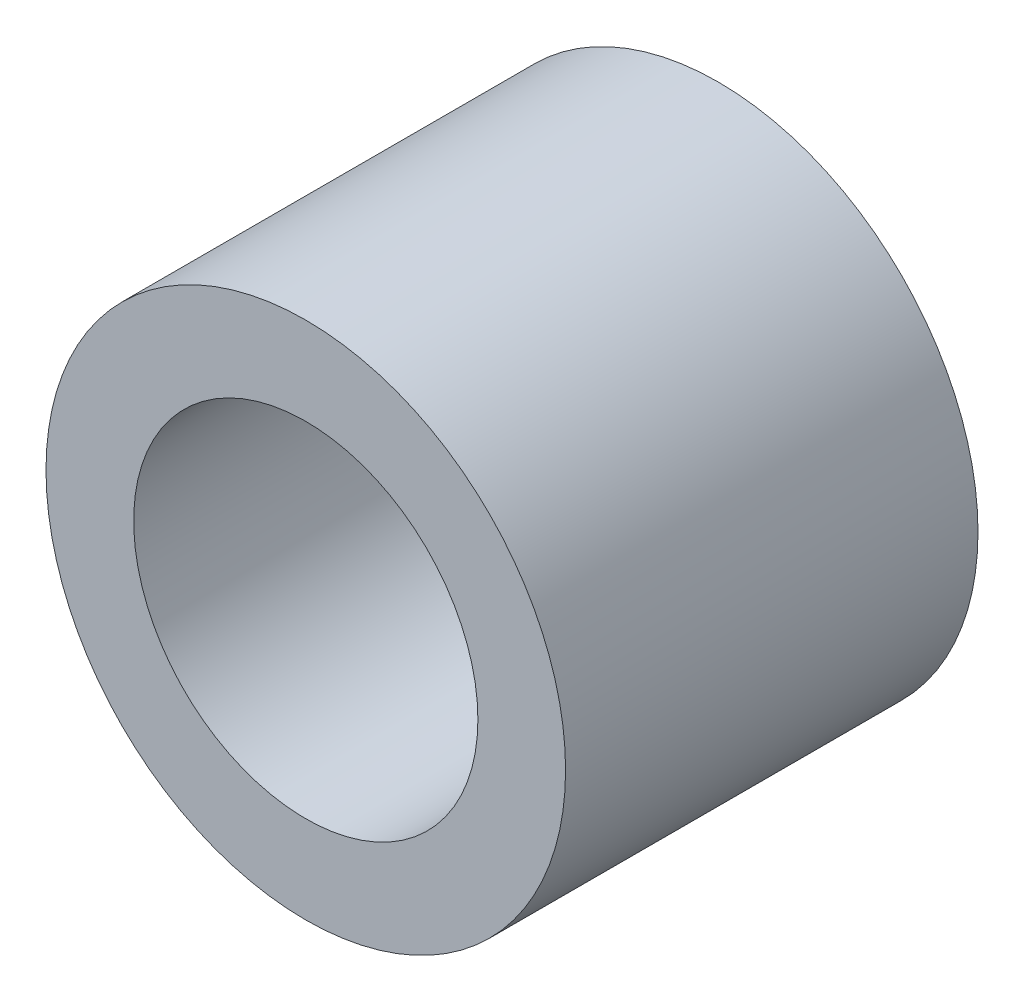
from build123d import *

# Parameters (mm, degrees)
ESQUISSE1_R        = 4
ESQUISSE1_R_2      = 2.65
BOSS_EXTRU_1_DEPTH = 3.175


with BuildPart() as part:
    # Esquisse1 → Boss.-Extru.1 (new, symmetric)
    with BuildSketch(Plane.XY):
        Circle(ESQUISSE1_R)
        Circle(ESQUISSE1_R_2, mode=Mode.SUBTRACT)
    extrude(amount=BOSS_EXTRU_1_DEPTH, both=True)


solid = part.part
